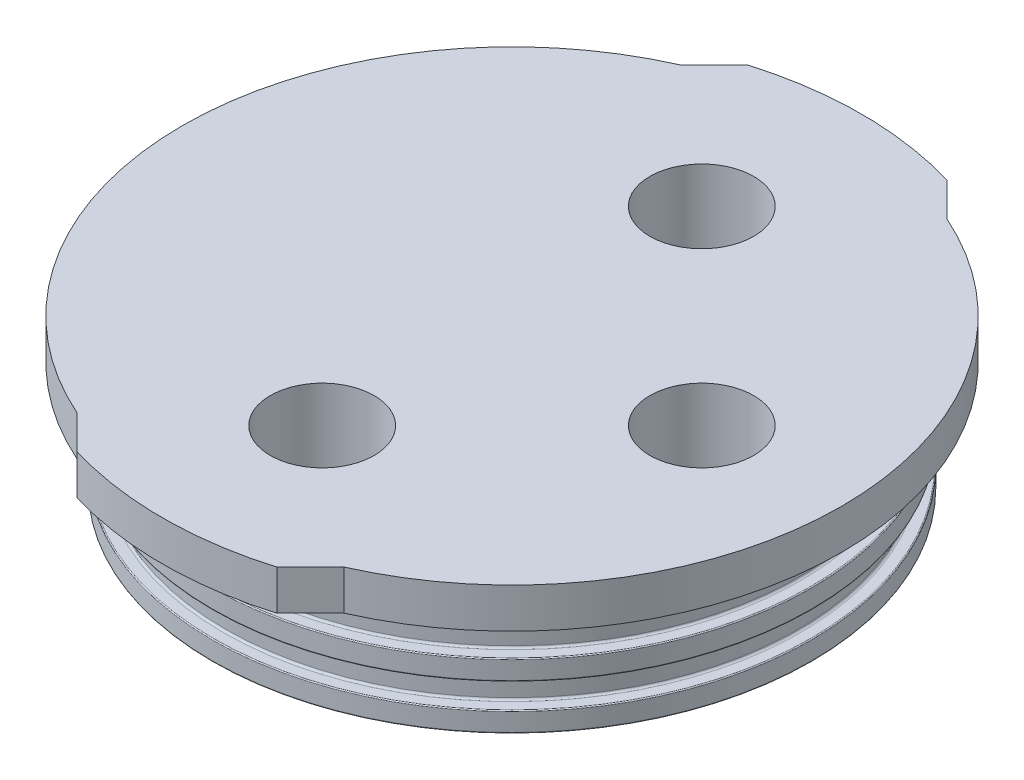
from build123d import *

# Parameters (mm, degrees)
SCHIZZO5_W                   = 5.2
SCHIZZO5_H                   = 15
RIPETIZIONECIRCOLARE1_COUNT  = 2
RIPETIZIONECIRCOLARE1_ANGLE  = 90
ESTRUSIONE_ESTRUSIONE1_START = -4
ESTRUSIONE_ESTRUSIONE1_DEPTH = 4
RIPETIZIONECIRCOLARE2_COUNT  = 2
RACCORDO1_R                  = 0.1
RACCORDO2_R                  = 0.2


with BuildPart() as part:
    # Schizzo3 → Rivoluzione1 (revolve)
    with BuildSketch(Plane.XY, mode=Mode.PRIVATE) as rivoluzione1_sk:
        Polygon((0, 15), (-33, 15), (-33, 11), (-30, 11), (-30, 9), (-28.7, 9), (-28.7, 6.5), (-30, 6.5), (-30, 4.5), (-28.7, 4.5), (-28.7, 2), (-30, 2), (-30, 0), (0, 0), align=None)
    revolve(rivoluzione1_sk.sketch.rotate(Axis((0, 0, 0), (0, 1, 0)), 270), axis=Axis((0, 0, 0), (0, 1, 0)))

    # Schizzo5 → Taglia-Rivoluzione2 (revolve, cut)
    with BuildSketch(Plane(origin=(0, 0, 0), x_dir=(0, 0, -1), z_dir=(1, 0, 0)), mode=Mode.PRIVATE) as taglia_rivoluzione2_sk:
        with Locations((21.6, 7.5)):
            Rectangle(SCHIZZO5_W, SCHIZZO5_H)
    taglia_rivoluzione2 = revolve(taglia_rivoluzione2_sk.sketch.rotate(Axis((0, 23.482826588, -19), (0, -1, 0)), 180), axis=Axis((0, 23.482826588, -19), (0, -1, 0)), mode=Mode.SUBTRACT)

    # Specchia1: Taglia-Rivoluzione2 across plane
    add(taglia_rivoluzione2.mirror(Plane.XY), mode=Mode.SUBTRACT)

    # RipetizioneCircolare1: Taglia-Rivoluzione2 ×2 about axis
    ripetizionecircolare1_axis = Axis((0, 15, 0), (0, -1, 0))
    for i in range(1, RIPETIZIONECIRCOLARE1_COUNT):
        add(taglia_rivoluzione2.rotate(ripetizionecircolare1_axis, i * RIPETIZIONECIRCOLARE1_ANGLE / (RIPETIZIONECIRCOLARE1_COUNT - 1)), mode=Mode.SUBTRACT)

    # Schizzo7 → Estrusione-Estrusione1 (add)
    with BuildSketch(Plane(origin=(0, 15, 0), x_dir=(1, 0, 0), z_dir=(0, 1, 0)).offset(ESTRUSIONE_ESTRUSIONE1_START)):
        with BuildLine():
            Line((-10, 33.541019662), (-13.371408588, 30.169611074))
            ThreePointArc((-13.371408588, 30.169611074), (0, 33), (13.371408588, 30.169611074))
            Line((13.371408588, 30.169611074), (10, 33.541019662))
            ThreePointArc((10, 33.541019662), (5.052935375, 34.633334291), (0, 35))
            ThreePointArc((0, 35), (-5.052935375, 34.633334291), (-10, 33.541019662))
        make_face()
    estrusione_estrusione1 = extrude(amount=ESTRUSIONE_ESTRUSIONE1_DEPTH)

    # RipetizioneCircolare2: Estrusione-Estrusione1 ×2 about axis
    ripetizionecircolare2_axis = Axis((0, 0, 0), (0, 1, 0))
    for i in range(1, RIPETIZIONECIRCOLARE2_COUNT):
        add(estrusione_estrusione1.rotate(ripetizionecircolare2_axis, i * 360 / RIPETIZIONECIRCOLARE2_COUNT))

    # Raccordo1
    raccordo1_edges = [part.edges().sort_by_distance(p)[0] for p in [
        (0, 2, 30),
        (0, 4.5, 30),
        (0, 6.5, 30),
        (0, 9, 30),
        (0, 0, 30),
    ]]
    fillet(raccordo1_edges, radius=RACCORDO1_R)

    # Raccordo2
    raccordo2_edges = [part.edges().sort_by_distance(p)[0] for p in [
        (0, 2, 28.7),
        (0, 4.5, 28.7),
        (0, 6.5, 28.7),
        (0, 9, 28.7),
    ]]
    fillet(raccordo2_edges, radius=RACCORDO2_R)


solid = part.part
